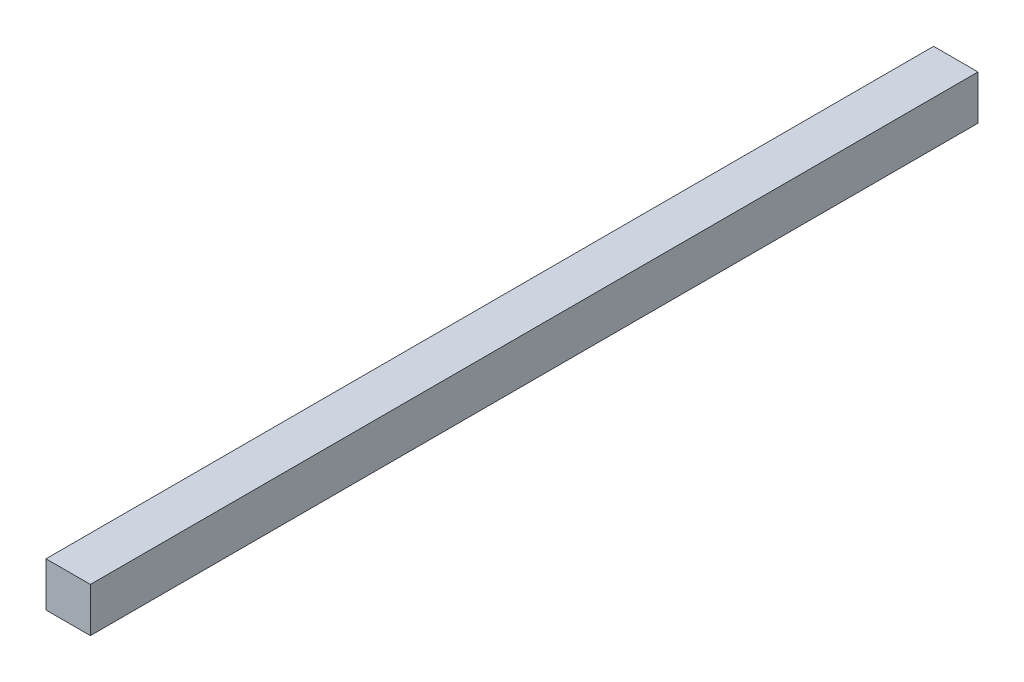
from build123d import *

# Parameters (mm, degrees)
SKETCH1_W           = 15.24
SKETCH1_H           = 15.24
BOSS_EXTRUDE1_DEPTH = 304.8


with BuildPart() as part:
    # Sketch1 → Boss-Extrude1 (new body)
    with BuildSketch(Plane.XY):
        with Locations((-7.62, 7.62)):
            Rectangle(SKETCH1_W, SKETCH1_H)
    extrude(amount=BOSS_EXTRUDE1_DEPTH)


solid = part.part
